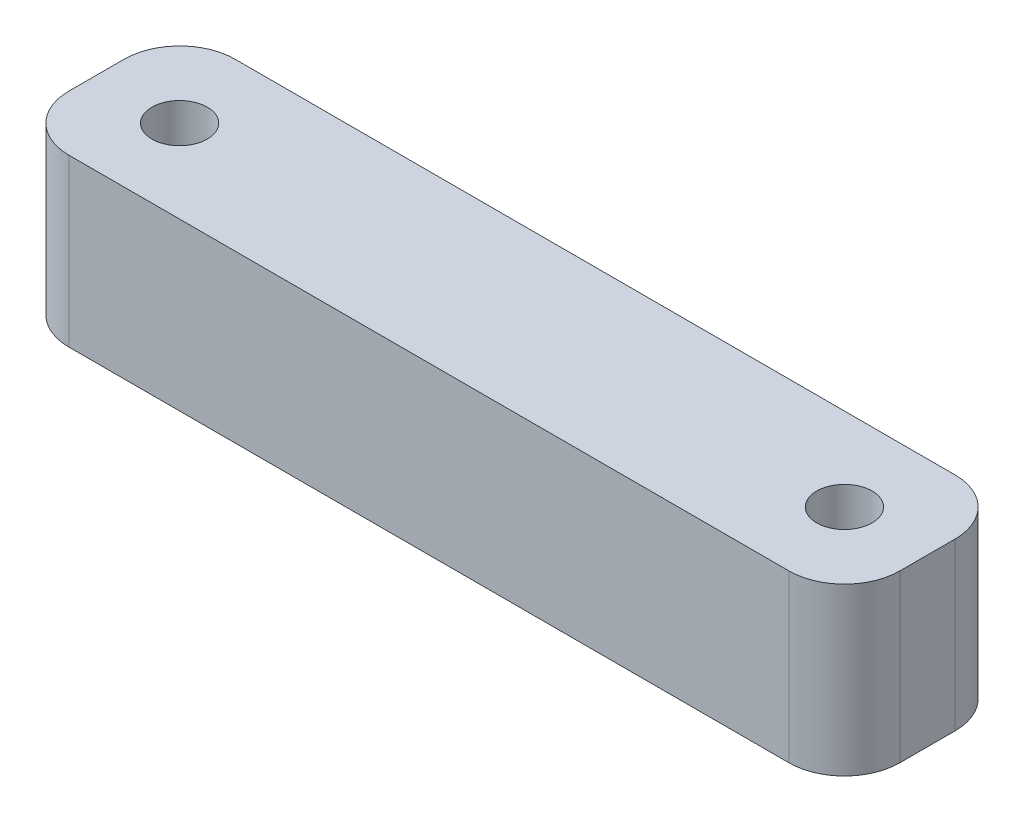
from build123d import *

# Parameters (mm, degrees)
SKETCH1_W           = 90
SKETCH1_H           = 30
SKETCH1_W_2         = 30
SKETCH1_R           = 5
BOSS_EXTRUDE1_DEPTH = 30
FILLET1_R           = 10


with BuildPart() as part:
    # Sketch1 → Boss-Extrude1 (new body)
    # profile 1 of 3: a face of its own
    with BuildSketch(Plane(origin=(0, 0, 0), x_dir=(1, 0, 0), z_dir=(0, 1, 0))):
        Rectangle(SKETCH1_W, SKETCH1_H)
    # profile 2 of 3: a face of its own
    with BuildSketch(Plane(origin=(0, 0, 0), x_dir=(1, 0, 0), z_dir=(0, 1, 0))):
        with Locations((60, 0)):
            Rectangle(SKETCH1_W_2, SKETCH1_H)
        with Locations(Location((60, 0, 0), (0, 0, 270))):
            Circle(SKETCH1_R, mode=Mode.SUBTRACT)
    # profile 3 of 3: a face of its own
    with BuildSketch(Plane(origin=(0, 0, 0), x_dir=(1, 0, 0), z_dir=(0, 1, 0))):
        with Locations((-60, 0)):
            Rectangle(SKETCH1_W_2, SKETCH1_H)
        with Locations(Location((-60, 0, 0), (0, 0, 270))):
            Circle(SKETCH1_R, mode=Mode.SUBTRACT)
    extrude(amount=BOSS_EXTRUDE1_DEPTH)

    # Fillet1
    fillet1_edges = [part.edges().sort_by_distance(p)[0] for p in [
        (-75, 15, 15),
        (-75, 15, -15),
        (75, 15, -15),
        (75, 15, 15),
    ]]
    fillet(fillet1_edges, radius=FILLET1_R)


solid = part.part
